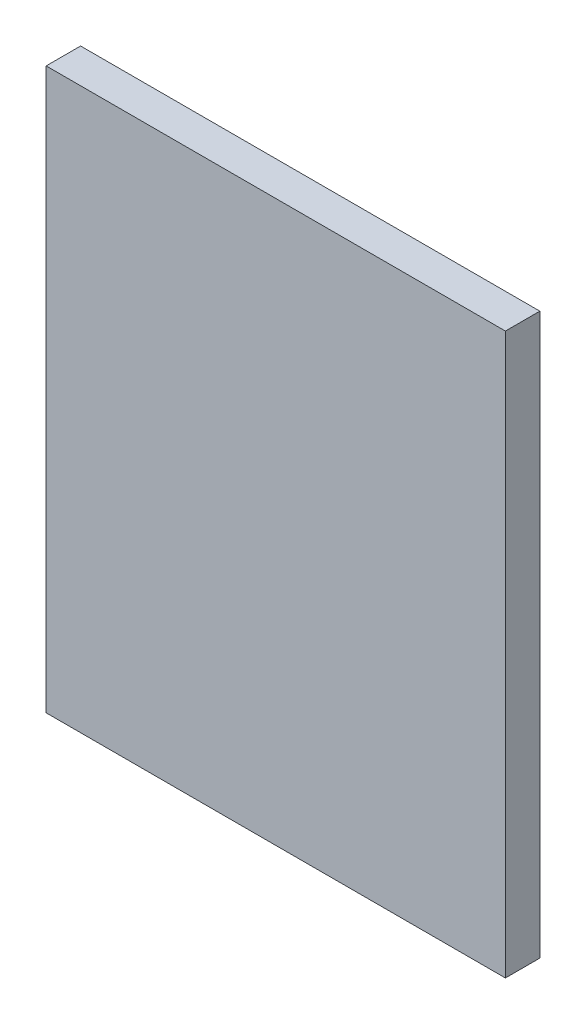
from build123d import *

# Parameters (mm, degrees)
CROQUIS2_W              = 244
CROQUIS2_H              = 200
SALIENTE_EXTRUIR1_DEPTH = 15


with BuildPart() as part:
    # Croquis2 → Saliente-Extruir1 (new body)
    with BuildSketch(Plane(origin=(0, 0, 0), x_dir=(0, 1, 0), z_dir=(0, 0, 1))):
        with Locations((122, 100)):
            Rectangle(CROQUIS2_W, CROQUIS2_H)
    extrude(amount=SALIENTE_EXTRUIR1_DEPTH)


solid = part.part
